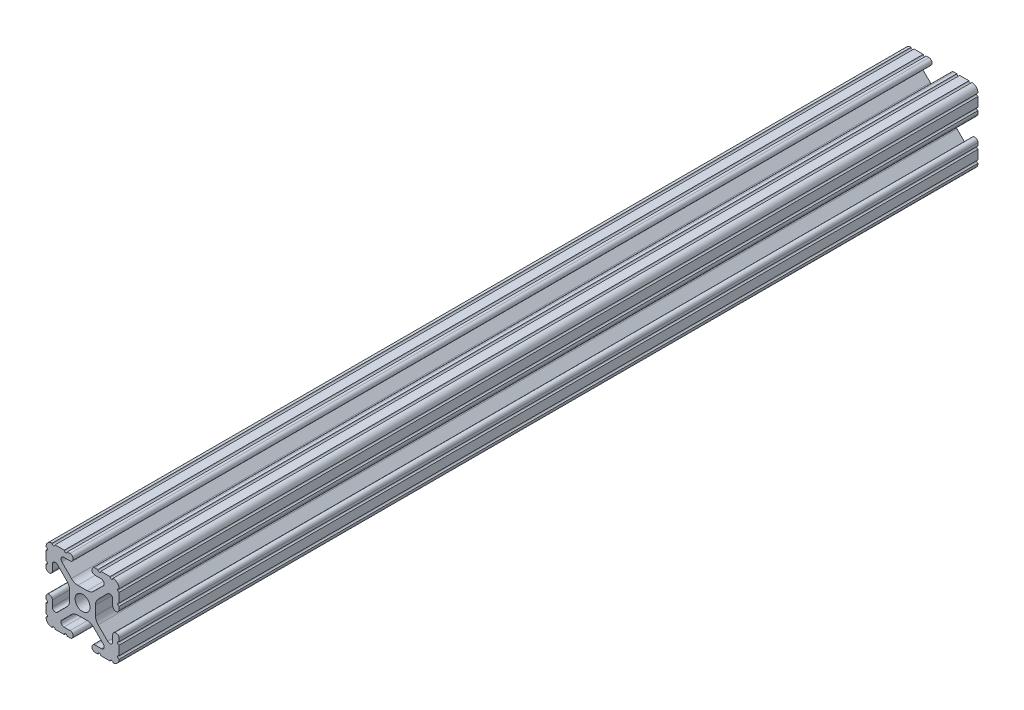
from build123d import *

# Parameters (mm, degrees)
SKETCH1_R           = 2.6035
BOSS_EXTRUDE1_DEPTH = 298.45


with BuildPart() as part:
    # Sketch1 → Boss-Extrude1 (new body)
    with BuildSketch(Plane(origin=(0, 0, -25.4), x_dir=(-1, 0, 0), z_dir=(0, 0, -1))):
        with BuildLine():
            Line((12.7, -9.5504), (12.7, -6.3330836))
            ThreePointArc((12.7, -6.3330836), (12.192, -5.8250836), (12.7, -5.3170836))
            Line((12.7, -5.3170836), (12.7, -4.3434))
            ThreePointArc((12.7, -4.3434), (11.5951, -3.2385), (10.4902, -4.3434))
            Line((10.4902, -4.3434), (10.4902, -6.474794456))
            ThreePointArc((10.4902, -6.474794456), (9.863006367, -7.413456061), (8.75577951, -7.193214945))
            Line((8.75577951, -7.193214945), (5.42573597, -3.863171405))
            ThreePointArc((5.42573597, -3.863171405), (4.737482484, -2.833127272), (4.4958, -1.618107374))
            Line((4.4958, -1.618107374), (4.4958, 1.618107374))
            ThreePointArc((4.4958, 1.618107374), (4.737482484, 2.833127272), (5.42573597, 3.863171405))
            Line((5.42573597, 3.863171405), (8.75577951, 7.193214945))
            ThreePointArc((8.75577951, 7.193214945), (9.863006367, 7.413456061), (10.4902, 6.474794456))
            Line((10.4902, 6.474794456), (10.4902, 4.343399971))
            ThreePointArc((10.4902, 4.343399971), (11.5951, 3.238499971), (12.7, 4.343399971))
            Line((12.7, 4.343399971), (12.7, 5.3170836))
            ThreePointArc((12.7, 5.3170836), (12.192, 5.8250836), (12.7, 6.3330836))
            Line((12.7, 6.3330836), (12.7, 9.5504))
            ThreePointArc((12.7, 9.5504), (12.192000006, 10.058323491), (12.699846982, 10.566399977))
            ThreePointArc((12.699846982, 10.566399977), (12.082522516, 12.082522516), (10.566399977, 12.699846982))
            ThreePointArc((10.566399977, 12.699846982), (10.058323491, 12.192000006), (9.5504, 12.7))
            Line((9.5504, 12.7), (6.3330836, 12.7))
            ThreePointArc((6.3330836, 12.7), (5.8250836, 12.192), (5.3170836, 12.7))
            Line((5.3170836, 12.7), (4.3434, 12.7))
            ThreePointArc((4.3434, 12.7), (3.2385, 11.5951), (4.3434, 10.4902))
            Line((4.3434, 10.4902), (6.474794456, 10.4902))
            ThreePointArc((6.474794456, 10.4902), (7.413456061, 9.863006367), (7.193214945, 8.75577951))
            Line((7.193214945, 8.75577951), (3.863171405, 5.42573597))
            ThreePointArc((3.863171405, 5.42573597), (2.833127272, 4.737482484), (1.618107374, 4.4958))
            Line((1.618107374, 4.4958), (-1.618107374, 4.4958))
            ThreePointArc((-1.618107374, 4.4958), (-2.833127272, 4.737482484), (-3.863171405, 5.42573597))
            Line((-3.863171405, 5.42573597), (-7.193214945, 8.75577951))
            ThreePointArc((-7.193214945, 8.75577951), (-7.413456061, 9.863006367), (-6.474794456, 10.4902))
            Line((-6.474794456, 10.4902), (-4.343399971, 10.4902))
            ThreePointArc((-4.343399971, 10.4902), (-3.238499971, 11.5951), (-4.343399971, 12.7))
            Line((-4.343399971, 12.7), (-5.3170836, 12.7))
            ThreePointArc((-5.3170836, 12.7), (-5.8250836, 12.192), (-6.3330836, 12.7))
            Line((-6.3330836, 12.7), (-9.5504, 12.7))
            ThreePointArc((-9.5504, 12.7), (-10.058323491, 12.192000006), (-10.566399977, 12.699846982))
            ThreePointArc((-10.566399977, 12.699846982), (-12.082522516, 12.082522516), (-12.699846982, 10.566399977))
            ThreePointArc((-12.699846982, 10.566399977), (-12.192000006, 10.058323491), (-12.7, 9.5504))
            Line((-12.7, 9.5504), (-12.7, 6.3330836))
            ThreePointArc((-12.7, 6.3330836), (-12.192, 5.8250836), (-12.7, 5.3170836))
            Line((-12.7, 5.3170836), (-12.7, 4.3434))
            ThreePointArc((-12.7, 4.3434), (-11.5951, 3.2385), (-10.4902, 4.3434))
            Line((-10.4902, 4.3434), (-10.4902, 6.474794456))
            ThreePointArc((-10.4902, 6.474794456), (-9.863006367, 7.413456061), (-8.75577951, 7.193214945))
            Line((-8.75577951, 7.193214945), (-5.42573597, 3.863171405))
            ThreePointArc((-5.42573597, 3.863171405), (-4.737482484, 2.833127272), (-4.4958, 1.618107374))
            Line((-4.4958, 1.618107374), (-4.4958, -1.618107374))
            ThreePointArc((-4.4958, -1.618107374), (-4.737482484, -2.833127272), (-5.42573597, -3.863171405))
            Line((-5.42573597, -3.863171405), (-8.75577951, -7.193214945))
            ThreePointArc((-8.75577951, -7.193214945), (-9.863006367, -7.413456061), (-10.4902, -6.474794456))
            Line((-10.4902, -6.474794456), (-10.4902, -4.343399971))
            ThreePointArc((-10.4902, -4.343399971), (-11.5951, -3.238499971), (-12.7, -4.343399971))
            Line((-12.7, -4.343399971), (-12.7, -5.3170836))
            ThreePointArc((-12.7, -5.3170836), (-12.192, -5.8250836), (-12.7, -6.3330836))
            Line((-12.7, -6.3330836), (-12.7, -9.5504))
            ThreePointArc((-12.7, -9.5504), (-12.192000006, -10.058323491), (-12.699846982, -10.566399977))
            ThreePointArc((-12.699846982, -10.566399977), (-12.082522516, -12.082522516), (-10.566399977, -12.699846982))
            ThreePointArc((-10.566399977, -12.699846982), (-10.058323491, -12.192000006), (-9.5504, -12.7))
            Line((-9.5504, -12.7), (-6.3330836, -12.7))
            ThreePointArc((-6.3330836, -12.7), (-5.8250836, -12.192), (-5.3170836, -12.7))
            Line((-5.3170836, -12.7), (-4.3434, -12.7))
            ThreePointArc((-4.3434, -12.7), (-3.2385, -11.5951), (-4.3434, -10.4902))
            Line((-4.3434, -10.4902), (-6.474794456, -10.4902))
            ThreePointArc((-6.474794456, -10.4902), (-7.413456061, -9.863006367), (-7.193214945, -8.75577951))
            Line((-7.193214945, -8.75577951), (-3.863171405, -5.42573597))
            ThreePointArc((-3.863171405, -5.42573597), (-2.833127272, -4.737482484), (-1.618107374, -4.4958))
            Line((-1.618107374, -4.4958), (1.618107374, -4.4958))
            ThreePointArc((1.618107374, -4.4958), (2.833127272, -4.737482484), (3.863171405, -5.42573597))
            Line((3.863171405, -5.42573597), (7.193214945, -8.75577951))
            ThreePointArc((7.193214945, -8.75577951), (7.413456061, -9.863006367), (6.474794456, -10.4902))
            Line((6.474794456, -10.4902), (4.343399971, -10.4902))
            ThreePointArc((4.343399971, -10.4902), (3.238499971, -11.5951), (4.343399971, -12.7))
            Line((4.343399971, -12.7), (5.3170836, -12.7))
            ThreePointArc((5.3170836, -12.7), (5.8250836, -12.192), (6.3330836, -12.7))
            Line((6.3330836, -12.7), (9.5504, -12.7))
            ThreePointArc((9.5504, -12.7), (10.058323491, -12.192000006), (10.566399977, -12.699846982))
            ThreePointArc((10.566399977, -12.699846982), (12.082522516, -12.082522516), (12.699846982, -10.566399977))
            ThreePointArc((12.699846982, -10.566399977), (12.192000006, -10.058323491), (12.7, -9.5504))
        make_face()
        with Locations(Location((0, 0, 0), (0, 0, 180))):
            Circle(SKETCH1_R, mode=Mode.SUBTRACT)
    extrude(amount=-BOSS_EXTRUDE1_DEPTH)


solid = part.part
